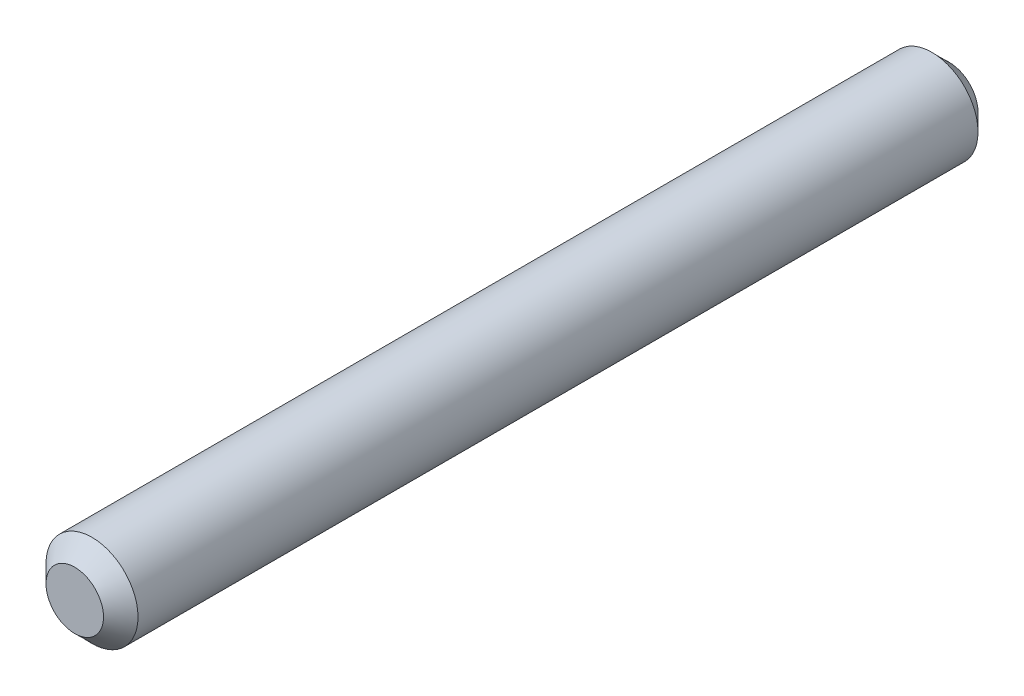
from build123d import *

# Parameters (mm, degrees)
SKETCH1_R           = 4
BOSS_EXTRUDE1_DEPTH = 76.03
CHAMFER1_SIZE       = 1.5


with BuildPart() as part:
    # Sketch1 → Boss-Extrude1 (new body)
    with BuildSketch(Plane.XY):
        Circle(SKETCH1_R)
    extrude(amount=BOSS_EXTRUDE1_DEPTH)

    # Chamfer1
    chamfer1_edges = [part.edges().sort_by_distance(p)[0] for p in [
        (-4, 0, 0),
        (-4, 0, 76.03),
    ]]
    chamfer(chamfer1_edges, length=CHAMFER1_SIZE)


solid = part.part
